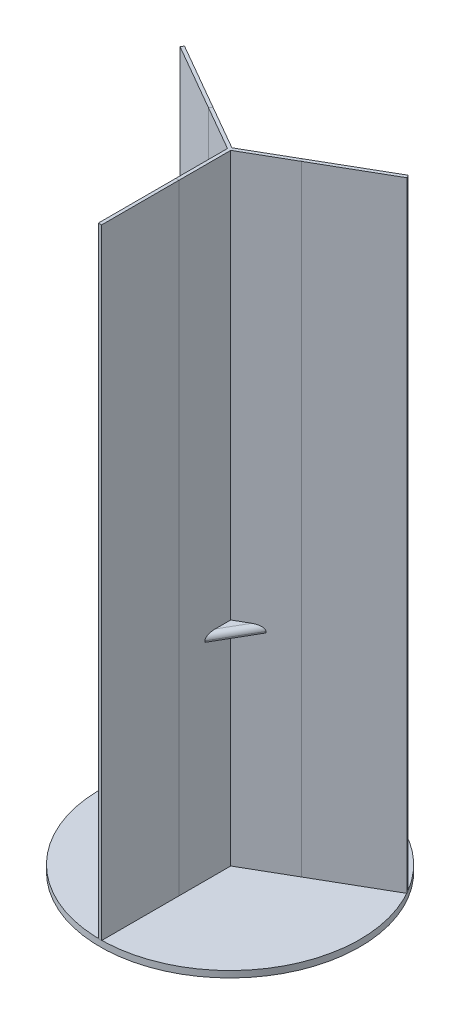
from build123d import *

# Parameters (mm, degrees)
BOSS_EXTRUDE1_DEPTH  = 2438.4
SKETCH6_W            = 12.682512264
SKETCH6_H            = 2438.4
BOSS_EXTRUDE5_DEPTH  = 304.8
SKETCH7_W            = 12.708378748
SKETCH7_H            = 2438.4
BOSS_EXTRUDE6_DEPTH  = 304.8
SKETCH8_W            = 12.708378748
SKETCH8_H            = 2438.4
BOSS_EXTRUDE7_DEPTH  = 304.8
SKETCH9_R            = 510.838723735
BOSS_EXTRUDE9_DEPTH  = 25.4
BOSS_EXTRUDE14_START = 812.8
BOSS_EXTRUDE14_DEPTH = 25.4
FILLET1_R            = 20.32
BOSS_EXTRUDE16_START = 812.8
BOSS_EXTRUDE16_DEPTH = 25.4
FILLET2_R            = 20.32
BOSS_EXTRUDE17_START = 812.8
BOSS_EXTRUDE17_DEPTH = 25.4
FILLET3_R            = 20.32


with BuildPart() as part:
    # Sketch1 → Boss-Extrude1 (new body)
    with BuildSketch(Plane(origin=(0, 0, 0), x_dir=(1, 0, 0), z_dir=(0, 1, 0))):
        Polygon((-176.095593552, 108.725422563), (0, 7.332218), (176.095593552, 108.725422563), (182.436849684, 97.712186841), (6.341256132, -3.681017722), (6.341256132, -206.881017722), (-6.341256132, -206.881017722), (-6.341256132, -3.681017722), (-182.436849684, 97.712186841), align=None)
    extrude(amount=BOSS_EXTRUDE1_DEPTH)

    # Sketch11 → Boss-Extrude14 (add)
    with BuildSketch(Plane(origin=(0, 0, 0), x_dir=(1, 0, 0), z_dir=(0, 1, 0)).offset(BOSS_EXTRUDE14_START)):
        Polygon((0, 7.332218), (88.047796776, 58.028820281), (-88.047796776, 58.028820281), align=None)
    extrude(amount=BOSS_EXTRUDE14_DEPTH)

    # Fillet1
    fillet1_edges = [part.edges().sort_by_distance(p)[0] for p in [
        (0, 838.2, -58.028820281),
    ]]
    fillet(fillet1_edges, radius=FILLET1_R)

    # Sketch13 → Boss-Extrude16 (add)
    with BuildSketch(Plane(origin=(0, 0, 0), x_dir=(1, 0, 0), z_dir=(0, 1, 0)).offset(BOSS_EXTRUDE16_START)):
        Polygon((6.341256132, -3.681017722), (6.341256132, -105.281017722), (94.389052908, 47.01558456), align=None)
    extrude(amount=BOSS_EXTRUDE16_DEPTH)

    # Fillet2
    fillet2_edges = [part.edges().sort_by_distance(p)[0] for p in [
        (50.36515452, 838.2, 29.132716581),
    ]]
    fillet(fillet2_edges, radius=FILLET2_R)

    # Sketch14 → Boss-Extrude17 (add)
    with BuildSketch(Plane(origin=(0, 0, 0), x_dir=(1, 0, 0), z_dir=(0, 1, 0)).offset(BOSS_EXTRUDE17_START)):
        Polygon((-6.341256132, -3.681017722), (-94.389052908, 47.01558456), (-6.341256132, -105.281017722), align=None)
    extrude(amount=BOSS_EXTRUDE17_DEPTH)

    # Fillet3
    fillet3_edges = [part.edges().sort_by_distance(p)[0] for p in [
        (-50.36515452, 838.2, 29.132716581),
    ]]
    fillet(fillet3_edges, radius=FILLET3_R)


with BuildPart() as body_2:
    # Sketch6 → Boss-Extrude5 (new body)
    with BuildSketch(Plane.XY.offset(206.881017722)):
        with Locations((0, 1219.2)):
            Rectangle(SKETCH6_W, SKETCH6_H)
    extrude(amount=BOSS_EXTRUDE5_DEPTH)


with BuildPart() as body_3:
    # Sketch7 → Boss-Extrude6 (new body)
    with BuildSketch(Plane(origin=(179.266221618, 0, -103.218804702), x_dir=(-0.49898230591919734, 0, -0.8666121729929489), z_dir=(0.8666121729929489, 0, -0.49898230591919734))):
        with Locations((0, 1219.2)):
            Rectangle(SKETCH7_W, SKETCH7_H)
    extrude(amount=BOSS_EXTRUDE6_DEPTH)


with BuildPart() as body_4:
    # Sketch8 → Boss-Extrude7 (new body)
    with BuildSketch(Plane(origin=(-179.266221618, 0, -103.218804702), x_dir=(-0.49898230591919357, 0, 0.866612172992951), z_dir=(-0.8666121729929509, 0, -0.4989823059191935))):
        with Locations((0, 1219.2)):
            Rectangle(SKETCH8_W, SKETCH8_H)
    extrude(amount=BOSS_EXTRUDE7_DEPTH)


with BuildPart() as body_5:
    # Sketch9 → Boss-Extrude9 (new body)
    with BuildSketch(Plane.XZ):
        with Locations(Location((0, 0, 0), (0, 0, 270))):
            Circle(SKETCH9_R)
    extrude(amount=BOSS_EXTRUDE9_DEPTH)


solid = Compound([part.part, body_2.part, body_3.part, body_4.part, body_5.part])
